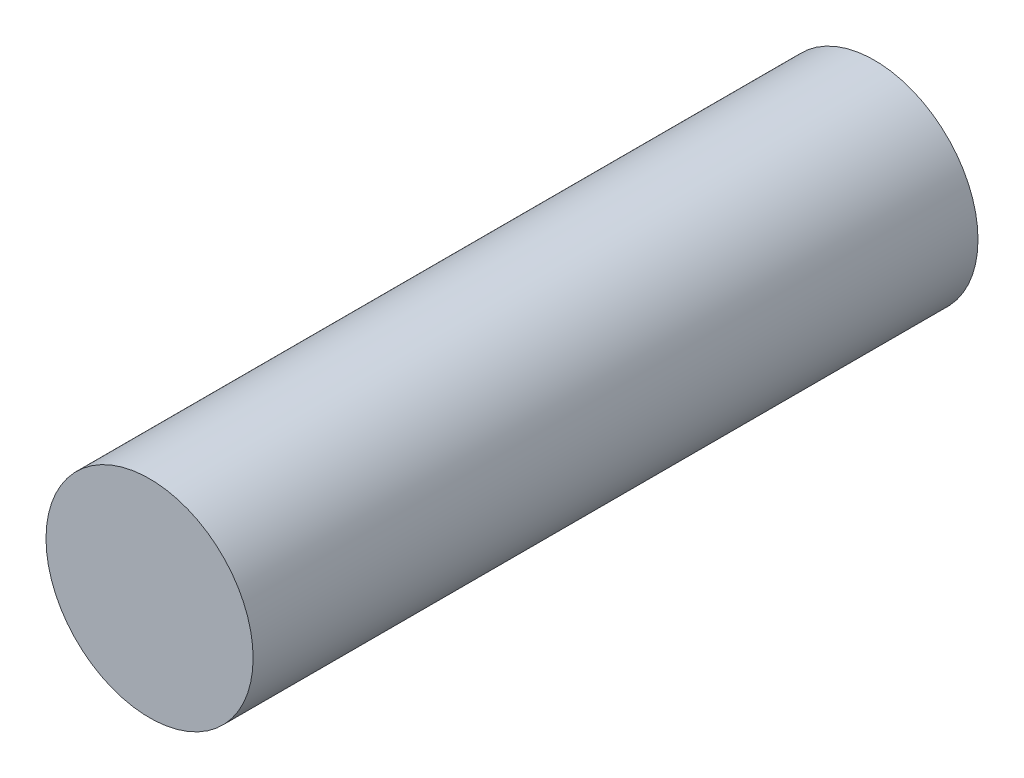
from build123d import *

# Parameters (mm, degrees)
SKETCH1_R           = 12.7
BOSS_EXTRUDE1_DEPTH = 88.9


with BuildPart() as part:
    # Sketch1 → Boss-Extrude1 (new body)
    with BuildSketch(Plane.XY):
        Circle(SKETCH1_R)
    extrude(amount=BOSS_EXTRUDE1_DEPTH)


solid = part.part
